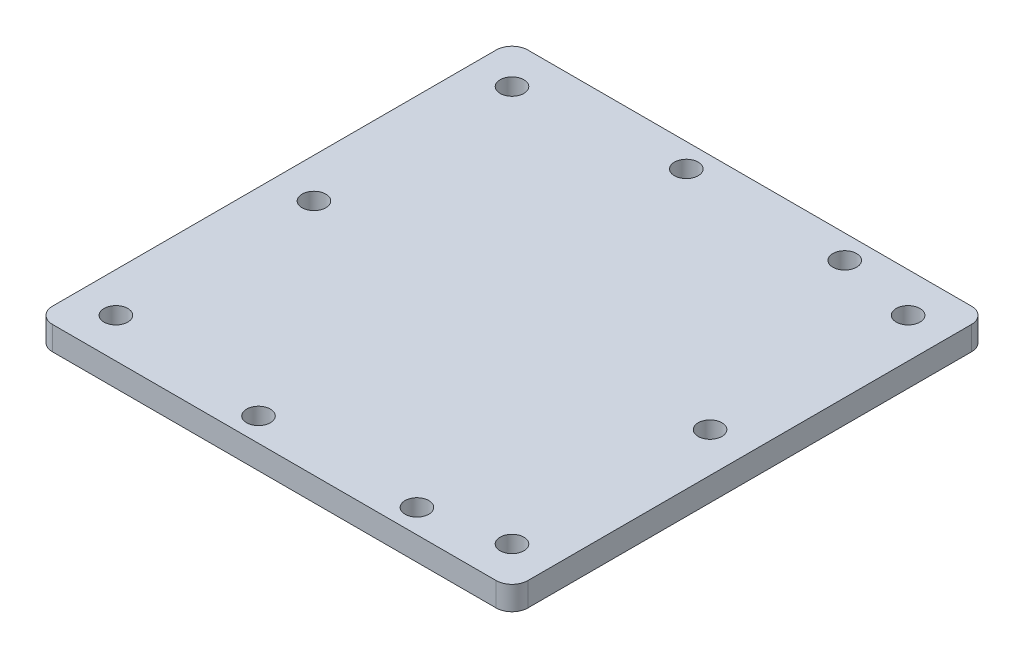
from build123d import *

# Parameters (mm, degrees)
SKETCH_1_W          = 60
SKETCH_1_H          = 60
SKETCH_1_R          = 1.5
EXTRUDE_1_DEPTH     = 3
SKETCH_2_R          = 1.5
CUT_EXTRUDE_1_DEPTH = 10
FILLET_1_R          = 2


with BuildPart() as part:
    # 草图1 → 凸台-拉伸1 (new body)
    with BuildSketch(Plane(origin=(0, 0, 0), x_dir=(1, 0, 0), z_dir=(0, 1, 0))):
        Rectangle(SKETCH_1_W, SKETCH_1_H)
        with Locations(Location((-5, 27, 0), (0, 0, 270))):
            Circle(SKETCH_1_R, mode=Mode.SUBTRACT)
        with Locations(Location((15, 27, 0), (0, 0, 270))):
            Circle(SKETCH_1_R, mode=Mode.SUBTRACT)
        with Locations(Location((15, -27, 0), (0, 0, 90))):
            Circle(SKETCH_1_R, mode=Mode.SUBTRACT)
        with Locations(Location((-5, -27, 0), (0, 0, 90))):
            Circle(SKETCH_1_R, mode=Mode.SUBTRACT)
        with Locations(Location((-25, 0, 0), (0, 0, 270))):
            Circle(SKETCH_1_R, mode=Mode.SUBTRACT)
        with Locations(Location((25, 0, 0), (0, 0, 270))):
            Circle(SKETCH_1_R, mode=Mode.SUBTRACT)
    extrude(amount=EXTRUDE_1_DEPTH)

    # 草图2 → 切除-拉伸1 (cut)
    with BuildSketch(Plane(origin=(0, 3, 0), x_dir=(1, 0, 0), z_dir=(0, 1, 0))):
        with Locations(Location((-25, 25, 0), (0, 0, 270))):
            Circle(SKETCH_2_R)
        with Locations(Location((25, 25, 0), (0, 0, 270))):
            Circle(SKETCH_2_R)
        with Locations(Location((-25, -25, 0), (0, 0, 270))):
            Circle(SKETCH_2_R)
        with Locations(Location((25, -25, 0), (0, 0, 270))):
            Circle(SKETCH_2_R)
    extrude(amount=-CUT_EXTRUDE_1_DEPTH, mode=Mode.SUBTRACT)

    # 圆角1
    fillet_1_edges = [part.edges().sort_by_distance(p)[0] for p in [
        (30, 1.5, 30),
        (-30, 1.5, 30),
        (-30, 1.5, -30),
        (30, 1.5, -30),
    ]]
    fillet(fillet_1_edges, radius=FILLET_1_R)


solid = part.part
